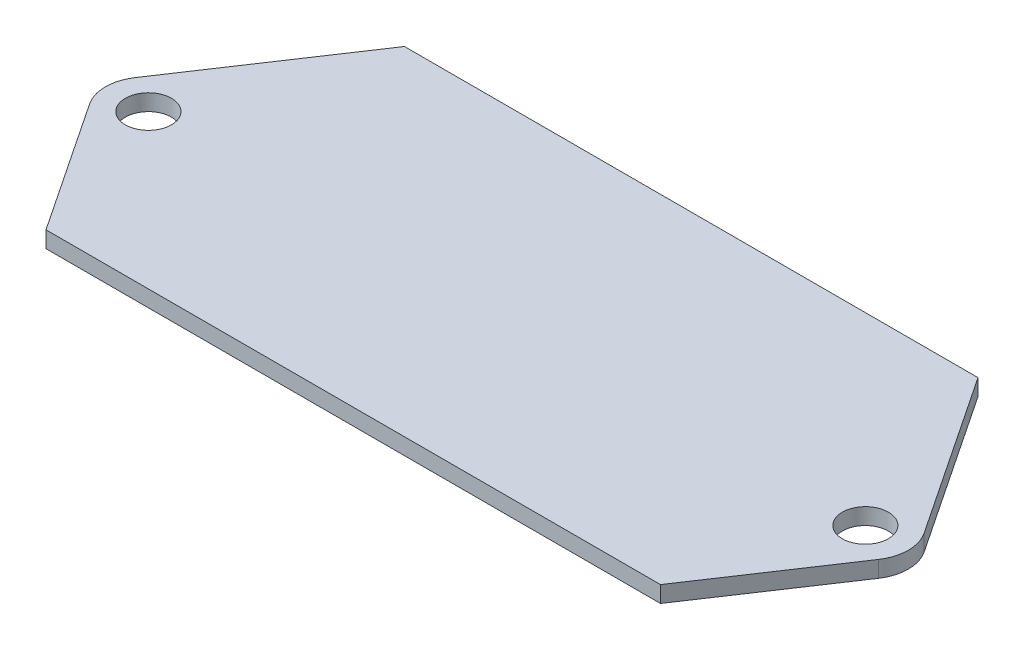
from build123d import *

# Parameters (mm, degrees)
SKETCH1_R           = 2.25
BOSS_EXTRUDE1_DEPTH = 1.6
FILLET1_R           = 4


with BuildPart() as part:
    # Sketch1 → Boss-Extrude1 (new body)
    with BuildSketch(Plane(origin=(0, 0, 0), x_dir=(1, 0, 0), z_dir=(0, 1, 0))):
        Polygon((12, 33), (0, 15), (10, 0), (70, 0), (80, 15), (68, 33), align=None)
        with Locations(Location((5, 15, 0), (0, 0, 270))):
            Circle(SKETCH1_R, mode=Mode.SUBTRACT)
        with Locations(Location((75, 15, 0), (0, 0, 270))):
            Circle(SKETCH1_R, mode=Mode.SUBTRACT)
    extrude(amount=BOSS_EXTRUDE1_DEPTH)

    # Fillet1
    fillet1_edges = [part.edges().sort_by_distance(p)[0] for p in [
        (0, 0.8, -15),
        (80, 0.8, -15),
    ]]
    fillet(fillet1_edges, radius=FILLET1_R)


solid = part.part
